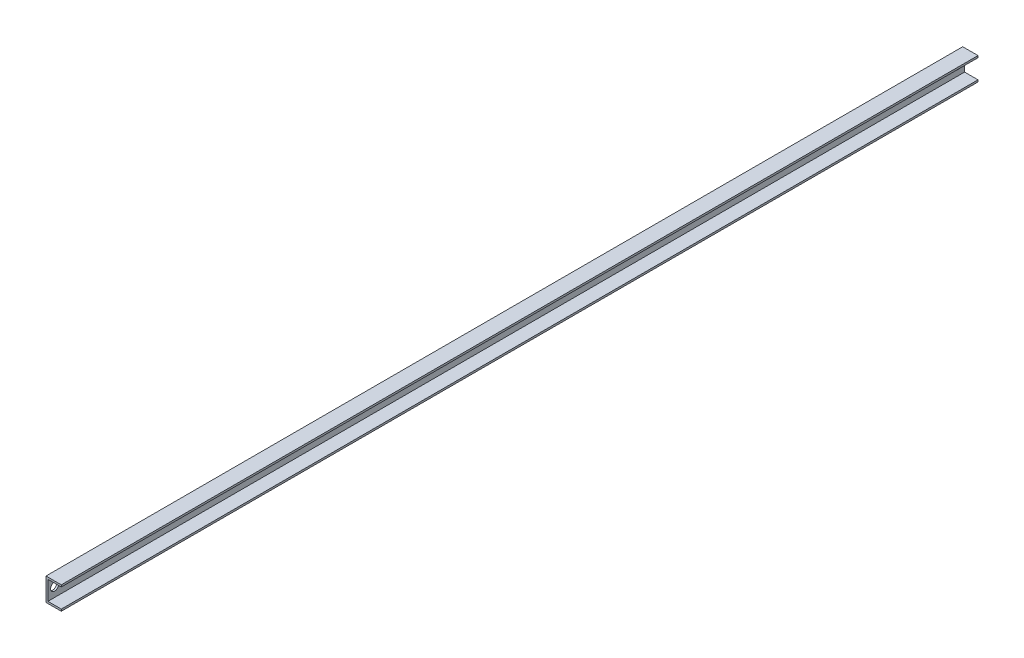
from build123d import *

# Parameters (mm, degrees)
BOSS_EXTRUDE1_DEPTH              = 762
F_17_64_0_26563_DIAMETER_HOLE1_D = 6.747002


with BuildPart() as part:
    # Sketch1 → Boss-Extrude1 (new body)
    with BuildSketch(Plane.XY):
        Polygon((0, 0), (12.7, 0), (12.7, 1.5875), (1.5875, 1.5875), (1.5875, 17.4625), (12.7, 17.4625), (12.7, 19.05), (0, 19.05), align=None)
    extrude(amount=BOSS_EXTRUDE1_DEPTH)

    # 17/64 (0.26563) Diameter Hole1 (through all)
    with Locations(Plane(origin=(0, 9.525, 5.588), x_dir=(0, -1, 0), z_dir=(-1, 0, 0))):
        with Locations((0, 0), (0, 39.624), (0, 711.199), (0, 750.824)):
            Hole(F_17_64_0_26563_DIAMETER_HOLE1_D / 2)


solid = part.part
